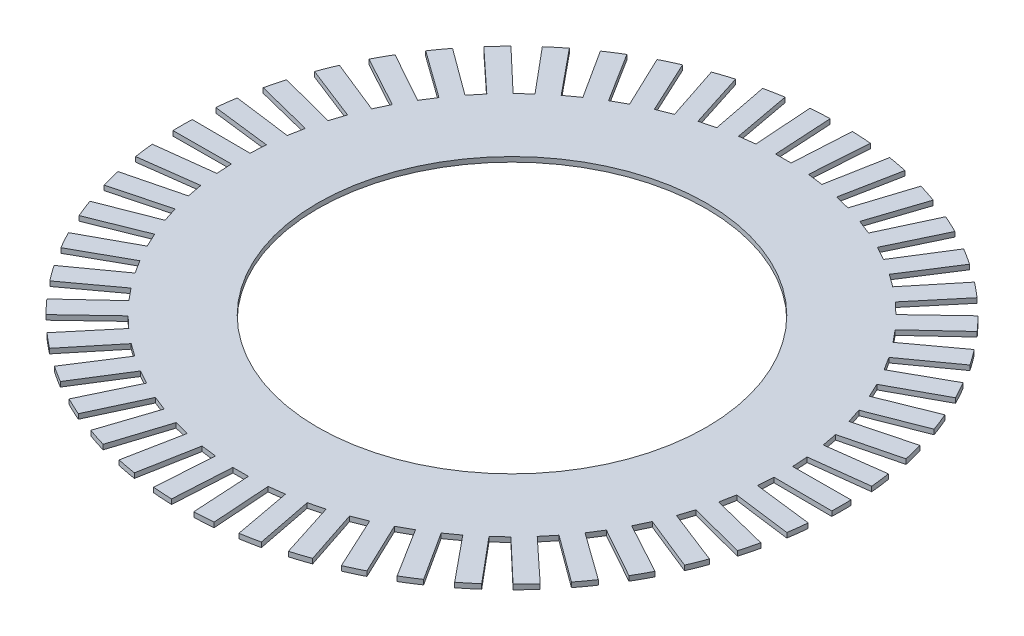
from build123d import *

# Parameters (mm, degrees)
SKETCH1_R           = 34
SKETCH1_R_2         = 20.05
BOSS_EXTRUDE2_DEPTH = 0.5
CUT_EXTRUDE1_DEPTH  = 0.5


with BuildPart() as part:
    # Sketch1 → Boss-Extrude2 (new body)
    with BuildSketch(Plane(origin=(0, 0, 0), x_dir=(1, 0, 0), z_dir=(0, 1, 0))):
        with Locations(Location((0, 0, 0), (0, 0, 270))):
            Circle(SKETCH1_R)
        with Locations(Location((0, 0, 0), (0, 0, 270))):
            Circle(SKETCH1_R_2, mode=Mode.SUBTRACT)
    extrude(amount=BOSS_EXTRUDE2_DEPTH)

    # Sketch2 → Cut-Extrude1 (cut)
    with BuildSketch(Plane(origin=(0, 0.5, 0), x_dir=(1, 0, 0), z_dir=(0, 1, 0))):
        Polygon((-1.2, 34.917249167), (1.2, 34.917249167), (0.8, 28.000059262), (-0.8, 28.000059262), align=None)
        Polygon((3.185754104, 34.792316109), (5.566829387, 34.491516348), (4.303029728, 27.679003845), (2.715646206, 27.879537018), align=None)
        Polygon((7.521266962, 34.118687441), (9.845866549, 33.521831712), (7.738198107, 26.921434002), (6.18846505, 27.319337822), align=None)
        Polygon((11.738164948, 32.906986691), (13.969628514, 32.023487764), (11.05133048, 25.739297063), (9.563688102, 26.328296347), align=None)
        Polygon((15.76994506, 31.176323103), (17.873081092, 30.020114285), (14.190176769, 24.151236034), (12.788086081, 24.922041912), align=None)
        Polygon((19.553023718, 28.953990276), (21.494664504, 27.54330567), (17.105235493, 22.182295585), (15.810808302, 23.122751988), align=None)
        Polygon((23.027739512, 26.275035726), (24.777264217, 24.632122672), (19.750534436, 19.863527083), (18.584184632, 20.958802453), align=None)
        Polygon((26.139294097, 23.181708167), (27.669111672, 21.332476384), (22.084355652, 17.231498894), (21.064477268, 18.464320082), align=None)
        Polygon((28.8386164, 19.722791221), (30.124600708, 17.6964042), (24.069893387, 14.327719673), (23.212570515, 15.678644354), align=None)
        Polygon((31.083136494, 15.952834077), (32.105006794, 13.781249151), (25.675834524, 11.197983754), (24.994587658, 12.645707038), align=None)
        Polygon((32.837456958, 11.931291209), (33.579097745, 9.64875557), (26.876852413, 7.891648942), (26.382425222, 9.413339369), align=None)
        Polygon((34.07391111, 7.721584752), (34.523626265, 5.36409535), (27.654006284, 4.460858112), (27.354196181, 6.032517714), align=None)
        Polygon((34.772999329, 3.39010429), (34.923696576, 0.994840142), (27.995039957, 0.959716885), (27.894575125, 2.556559651), align=None)
        Polygon((34.923696576, -0.994840142), (34.772999329, -3.39010429), (27.894575125, -2.556559651), (27.995039957, -0.959716885), align=None)
        Polygon((34.523626265, -5.36409535), (34.07391111, -7.721584752), (27.354196181, -6.032517714), (27.654006284, -4.460858112), align=None)
        Polygon((33.579097745, -9.64875557), (32.837456958, -11.931291209), (26.382425222, -9.413339369), (26.876852413, -7.891648942), align=None)
        Polygon((32.105006794, -13.781249151), (31.083136494, -15.952834077), (24.994587658, -12.645707038), (25.675834524, -11.197983754), align=None)
        Polygon((30.124600708, -17.6964042), (28.8386164, -19.722791221), (23.212570515, -15.678644354), (24.069893387, -14.327719673), align=None)
        Polygon((27.669111672, -21.332476384), (26.139294097, -23.181708167), (21.064477268, -18.464320082), (22.084355652, -17.231498894), align=None)
        Polygon((24.777264217, -24.632122672), (23.027739512, -26.275035726), (18.584184632, -20.958802453), (19.750534436, -19.863527083), align=None)
        Polygon((21.494664504, -27.54330567), (19.553023718, -28.953990276), (15.810808302, -23.122751988), (17.105235493, -22.182295585), align=None)
        Polygon((17.873081092, -30.020114285), (15.76994506, -31.176323103), (12.788086081, -24.922041912), (14.190176769, -24.151236034), align=None)
        Polygon((13.969628514, -32.023487764), (11.738164948, -32.906986691), (9.563688102, -26.328296347), (11.05133048, -25.739297063), align=None)
        Polygon((9.845866549, -33.521831712), (7.521266962, -34.118687441), (6.18846505, -27.319337822), (7.738198107, -26.921434002), align=None)
        Polygon((5.566829387, -34.491516348), (3.185754104, -34.792316109), (2.715646206, -27.879537018), (4.303029728, -27.679003845), align=None)
        Polygon((1.2, -34.917249167), (-1.2, -34.917249167), (-0.8, -28.000059262), (0.8, -28.000059262), align=None)
        Polygon((-3.185754104, -34.792316109), (-5.566829387, -34.491516348), (-4.303029728, -27.679003845), (-2.715646206, -27.879537018), align=None)
        Polygon((-7.521266962, -34.118687441), (-9.845866549, -33.521831712), (-7.738198107, -26.921434002), (-6.18846505, -27.319337822), align=None)
        Polygon((-11.738164948, -32.906986691), (-13.969628514, -32.023487764), (-11.05133048, -25.739297063), (-9.563688102, -26.328296347), align=None)
        Polygon((-15.76994506, -31.176323103), (-17.873081092, -30.020114285), (-14.190176769, -24.151236034), (-12.788086081, -24.922041912), align=None)
        Polygon((-19.553023718, -28.953990276), (-21.494664504, -27.54330567), (-17.105235493, -22.182295585), (-15.810808302, -23.122751988), align=None)
        Polygon((-23.027739512, -26.275035726), (-24.777264217, -24.632122672), (-19.750534436, -19.863527083), (-18.584184632, -20.958802453), align=None)
        Polygon((-26.139294097, -23.181708167), (-27.669111672, -21.332476384), (-22.084355652, -17.231498894), (-21.064477268, -18.464320082), align=None)
        Polygon((-28.8386164, -19.722791221), (-30.124600708, -17.6964042), (-24.069893387, -14.327719673), (-23.212570515, -15.678644354), align=None)
        Polygon((-31.083136494, -15.952834077), (-32.105006794, -13.781249151), (-25.675834524, -11.197983754), (-24.994587658, -12.645707038), align=None)
        Polygon((-32.837456958, -11.931291209), (-33.579097745, -9.64875557), (-26.876852413, -7.891648942), (-26.382425222, -9.413339369), align=None)
        Polygon((-34.07391111, -7.721584752), (-34.523626265, -5.36409535), (-27.654006284, -4.460858112), (-27.354196181, -6.032517714), align=None)
        Polygon((-34.772999329, -3.39010429), (-34.923696576, -0.994840142), (-27.995039957, -0.959716885), (-27.894575125, -2.556559651), align=None)
        Polygon((-34.923696576, 0.994840142), (-34.772999329, 3.39010429), (-27.894575125, 2.556559651), (-27.995039957, 0.959716885), align=None)
        Polygon((-34.523626265, 5.36409535), (-34.07391111, 7.721584752), (-27.354196181, 6.032517714), (-27.654006284, 4.460858112), align=None)
        Polygon((-33.579097745, 9.64875557), (-32.837456958, 11.931291209), (-26.382425222, 9.413339369), (-26.876852413, 7.891648942), align=None)
        Polygon((-32.105006794, 13.781249151), (-31.083136494, 15.952834077), (-24.994587658, 12.645707038), (-25.675834524, 11.197983754), align=None)
        Polygon((-30.124600708, 17.6964042), (-28.8386164, 19.722791221), (-23.212570515, 15.678644354), (-24.069893387, 14.327719673), align=None)
        Polygon((-27.669111672, 21.332476384), (-26.139294097, 23.181708167), (-21.064477268, 18.464320082), (-22.084355652, 17.231498894), align=None)
        Polygon((-24.777264217, 24.632122672), (-23.027739512, 26.275035726), (-18.584184632, 20.958802453), (-19.750534436, 19.863527083), align=None)
        Polygon((-21.494664504, 27.54330567), (-19.553023718, 28.953990276), (-15.810808302, 23.122751988), (-17.105235493, 22.182295585), align=None)
        Polygon((-17.873081092, 30.020114285), (-15.76994506, 31.176323103), (-12.788086081, 24.922041912), (-14.190176769, 24.151236034), align=None)
        Polygon((-13.969628514, 32.023487764), (-11.738164948, 32.906986691), (-9.563688102, 26.328296347), (-11.05133048, 25.739297063), align=None)
        Polygon((-9.845866549, 33.521831712), (-7.521266962, 34.118687441), (-6.18846505, 27.319337822), (-7.738198107, 26.921434002), align=None)
        Polygon((-5.566829387, 34.491516348), (-3.185754104, 34.792316109), (-2.715646206, 27.879537018), (-4.303029728, 27.679003845), align=None)
    extrude(amount=-CUT_EXTRUDE1_DEPTH, mode=Mode.SUBTRACT)


solid = part.part
